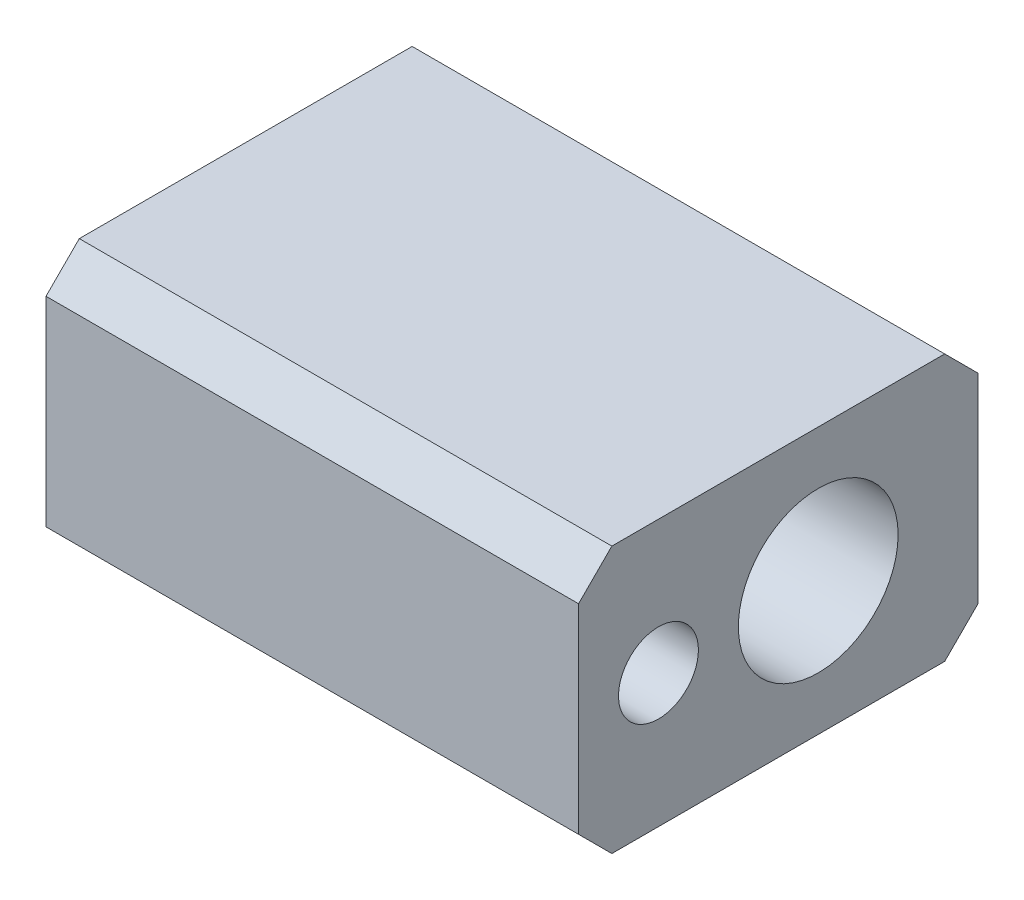
from build123d import *

# Parameters (mm, degrees)
SKETCH1_W           = 50.8
SKETCH1_H           = 76.2
SKETCH1_R           = 15.24
SKETCH1_R_2         = 7.62
BOSS_EXTRUDE1_DEPTH = 101.6
CHAMFER2_SIZE       = 6.35
CHAMFER1_SIZE       = 6.35


with BuildPart() as part:
    # Sketch1 → Boss-Extrude1 (new body)
    with BuildSketch(Plane.YZ):
        Rectangle(SKETCH1_W, SKETCH1_H)
        with Locations(Location((0, -7.62, 0), (0, 0, 270))):
            Circle(SKETCH1_R, mode=Mode.SUBTRACT)
        with Locations(Location((0, 22.86, 0), (0, 0, 270))):
            Circle(SKETCH1_R_2, mode=Mode.SUBTRACT)
    extrude(amount=BOSS_EXTRUDE1_DEPTH)

    # Chamfer2
    chamfer2_edges = [part.edges().sort_by_distance(p)[0] for p in [
        (50.8, -25.4, 38.1),
        (50.8, -25.4, -38.1),
    ]]
    chamfer(chamfer2_edges, length=CHAMFER2_SIZE)

    # Chamfer1
    chamfer1_edges = [part.edges().sort_by_distance(p)[0] for p in [
        (50.8, 25.4, 38.1),
        (50.8, 25.4, -38.1),
    ]]
    chamfer(chamfer1_edges, length=CHAMFER1_SIZE)


solid = part.part
